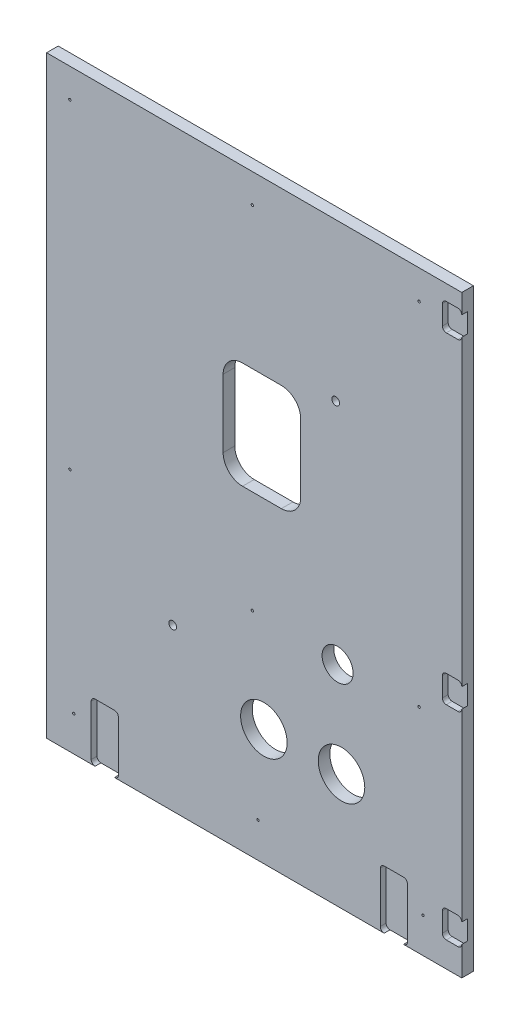
from build123d import *

# Parameters (mm, degrees)
SKETCH_1_W          = 1070
SKETCH_1_H          = 1530
EXTRUDE_1_DEPTH     = 15
SKETCH_2_R          = 40
SKETCH_2_R_2        = 60
SKETCH_2_R_3        = 10
CUT_EXTRUDE_1_DEPTH = 934.996788003
CUT_EXTRUDE_2_DEPTH = 15
SKETCH_5_R          = 3
CUT_EXTRUDE_3_DEPTH = 934.996788003


with BuildPart() as part:
    # Эскиз1 → Бобышка-Вытянуть1 (new, symmetric)
    with BuildSketch(Plane.XY):
        Rectangle(SKETCH_1_W, SKETCH_1_H)
    extrude(amount=EXTRUDE_1_DEPTH, both=True)

    # Эскиз2 → Вырез-Вытянуть1 (cut, through all)
    with BuildSketch(Plane.XY.offset(15)):
        with Locations((215, -225)):
            Circle(SKETCH_2_R)
        with Locations((225, -465)):
            Circle(SKETCH_2_R_2)
        with Locations((25, -465)):
            Circle(SKETCH_2_R_2)
        with Locations((210, 360)):
            Circle(SKETCH_2_R_3)
        with Locations((-210, -350)):
            Circle(SKETCH_2_R_3)
        with BuildLine():
            Line((-30, 325), (70, 325))
            ThreePointArc((70, 325), (105.355339059, 310.355339059), (120, 275))
            Line((120, 275), (120, 100))
            ThreePointArc((120, 100), (105.355339059, 64.644660941), (70, 50))
            Line((70, 50), (-30, 50))
            ThreePointArc((-30, 50), (-65.355339059, 64.644660941), (-80, 100))
            Line((-80, 100), (-80, 275))
            ThreePointArc((-80, 275), (-65.355339059, 310.355339059), (-30, 325))
        make_face()
    extrude(amount=-CUT_EXTRUDE_1_DEPTH, mode=Mode.SUBTRACT)

    # Эскиз4 → Вырез-Вытянуть2 (cut)
    with BuildSketch(Plane.XY.offset(15)):
        with BuildLine():
            Line((495, -105), (525, -105))
            ThreePointArc((525, -105), (532.071067812, -107.928932188), (535, -115))
            Line((535, -115), (535, -165))
            ThreePointArc((535, -165), (532.071067812, -172.071067812), (525, -175))
            Line((525, -175), (495, -175))
            ThreePointArc((495, -175), (487.928932188, -172.071067812), (485, -165))
            Line((485, -165), (485, -115))
            ThreePointArc((485, -115), (487.928932188, -107.928932188), (495, -105))
        make_face()
        with BuildLine():
            Line((495, -630), (525, -630))
            ThreePointArc((525, -630), (532.071067812, -632.928932188), (535, -640))
            Line((535, -640), (535, -690))
            ThreePointArc((535, -690), (532.071067812, -697.071067812), (525, -700))
            Line((525, -700), (495, -700))
            ThreePointArc((495, -700), (487.928932188, -697.071067812), (485, -690))
            Line((485, -690), (485, -640))
            ThreePointArc((485, -640), (487.928932188, -632.928932188), (495, -630))
        make_face()
        with BuildLine():
            Line((-410, -615), (-360, -615))
            ThreePointArc((-360, -615), (-352.928932188, -617.928932188), (-350, -625))
            Line((-350, -625), (-350, -755))
            ThreePointArc((-350, -755), (-352.928932188, -762.071067812), (-360, -765))
            Line((-360, -765), (-410, -765))
            ThreePointArc((-410, -765), (-417.071067812, -762.071067812), (-420, -755))
            Line((-420, -755), (-420, -625))
            ThreePointArc((-420, -625), (-417.071067812, -617.928932188), (-410, -615))
        make_face()
        with BuildLine():
            Line((495, 725), (525, 725))
            ThreePointArc((525, 725), (532.071067812, 722.071067812), (535, 715))
            Line((535, 715), (535, 665))
            ThreePointArc((535, 665), (532.071067812, 657.928932188), (525, 655))
            Line((525, 655), (495, 655))
            ThreePointArc((495, 655), (487.928932188, 657.928932188), (485, 665))
            Line((485, 665), (485, 715))
            ThreePointArc((485, 715), (487.928932188, 722.071067812), (495, 725))
        make_face()
        with BuildLine():
            Line((335, -615), (385, -615))
            ThreePointArc((385, -615), (392.071067812, -617.928932188), (395, -625))
            Line((395, -625), (395, -755))
            ThreePointArc((395, -755), (392.071067812, -762.071067812), (385, -765))
            Line((385, -765), (335, -765))
            ThreePointArc((335, -765), (327.928932188, -762.071067812), (325, -755))
            Line((325, -755), (325, -625))
            ThreePointArc((325, -625), (327.928932188, -617.928932188), (335, -615))
        make_face()
    extrude(amount=-CUT_EXTRUDE_2_DEPTH, mode=Mode.SUBTRACT)

    # Эскиз5 → Вырез-Вытянуть3 (cut, through all)
    with BuildSketch(Plane.XY.offset(15)):
        with Locations((-475, 690)):
            Circle(SKETCH_5_R)
        with Locations((-5, 690)):
            Circle(SKETCH_5_R)
        with Locations((425, 690)):
            Circle(SKETCH_5_R)
        with Locations((-475, -135)):
            Circle(SKETCH_5_R)
        with Locations((-5, -215)):
            Circle(SKETCH_5_R)
        with Locations((425, -215)):
            Circle(SKETCH_5_R)
        with Locations((-465, -675)):
            Circle(SKETCH_5_R)
        with Locations((10, -675)):
            Circle(SKETCH_5_R)
        with Locations((435, -675)):
            Circle(SKETCH_5_R)
    extrude(amount=-CUT_EXTRUDE_3_DEPTH, mode=Mode.SUBTRACT)


solid = part.part
